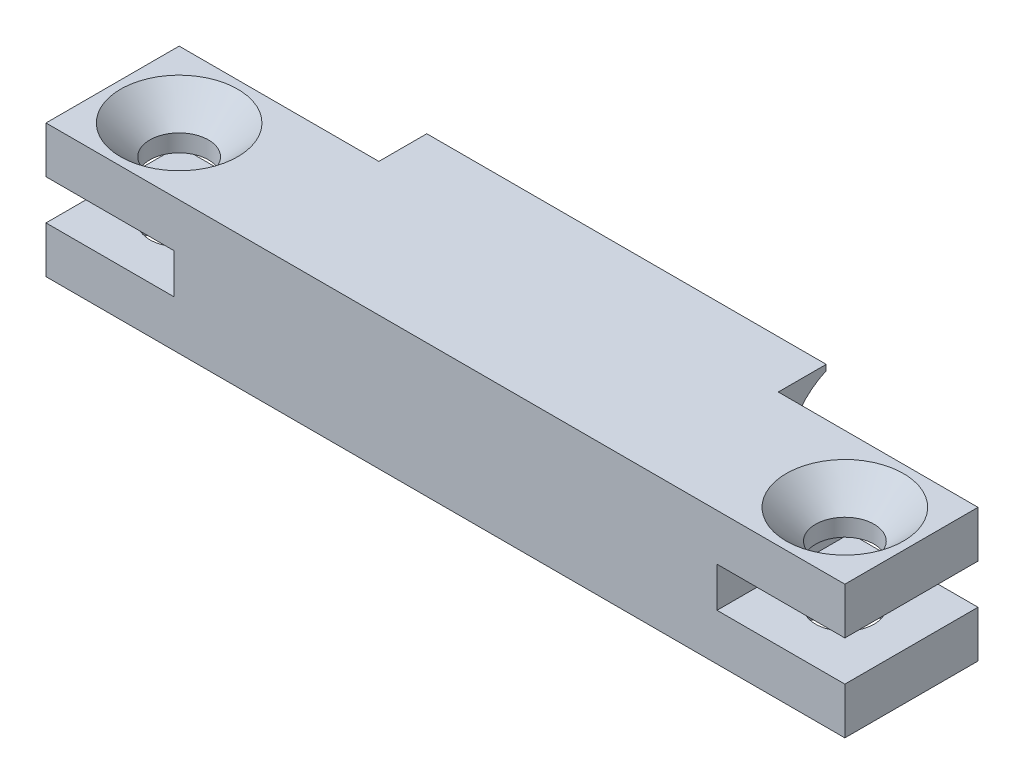
from build123d import *

# Parameters (mm, degrees)
EXTRUDE_1_DEPTH             = 15
SKETCH_2_W                  = 1
SKETCH_2_H                  = 1
CUT_EXTRUDE_1_DEPTH         = 15
SKETCH_6_W                  = 5
SKETCH_6_H                  = 1.75
EXTRUDE_2_DEPTH             = 7.5
SKETCH_7_W                  = 5
SKETCH_7_H                  = 1.75
EXTRUDE_3_DEPTH             = 7.5
HOLE_WIZARD_M21_D           = 2.2
HOLE_WIZARD_M21_CSINK_D     = 4.4
HOLE_WIZARD_M21_CSINK_ANGLE = 90
CUT_EXTRUDE_2_DEPTH         = 1.2
SKETCH_8_W                  = 2.7
SKETCH_8_H                  = 1.5
EXTRUDE_4_DEPTH             = 5


with BuildPart() as part:
    # Эскиз1 → Бобышка-Вытянуть1 (new body)
    with BuildSketch(Plane(origin=(0, 0, 0), x_dir=(0, 0, -1), z_dir=(1, 0, 0))):
        with BuildLine():
            Line((0, 2.5), (0, -2.5))
            Line((0, -2.5), (7.8, -2.5))
            ThreePointArc((7.8, -2.5), (5.3, 0), (7.8, 2.5))
            Line((7.8, 2.5), (0, 2.5))
        make_face()
    extrude(amount=EXTRUDE_1_DEPTH)

    # Эскиз2 → Вырез-Вытянуть1 (cut)
    with BuildSketch(Plane(origin=(15, 0, 0), x_dir=(0, 0, -1), z_dir=(1, 0, 0))):
        with Locations((7.3, 2)):
            Rectangle(SKETCH_2_W, SKETCH_2_H)
        with Locations((7.3, -2)):
            Rectangle(SKETCH_2_W, SKETCH_2_H)
    extrude(amount=-CUT_EXTRUDE_1_DEPTH, mode=Mode.SUBTRACT)

    # Эскиз6 → Бобышка-Вытянуть2 (add)
    with BuildSketch(Plane.ZY):
        with Locations((-2.5, 1.625)):
            Rectangle(SKETCH_6_W, SKETCH_6_H)
        with Locations((-2.5, -1.625)):
            Rectangle(SKETCH_6_W, SKETCH_6_H)
    extrude(amount=EXTRUDE_2_DEPTH)

    # Эскиз7 → Бобышка-Вытянуть3 (add)
    with BuildSketch(Plane(origin=(15, 0, 0), x_dir=(0, 0, -1), z_dir=(1, 0, 0))):
        with Locations((2.5, 1.625)):
            Rectangle(SKETCH_7_W, SKETCH_7_H)
        with Locations((2.5, -1.625)):
            Rectangle(SKETCH_7_W, SKETCH_7_H)
    extrude(amount=EXTRUDE_3_DEPTH)

    # Зенковка для винта с полупотайной головкой M21 (through all)
    with Locations(Plane(origin=(0, 2.5, 0), x_dir=(1, 0, 0), z_dir=(0, 1, 0))):
        with Locations((20, 2.5), (-5, 2.5)):
            CounterSinkHole(HOLE_WIZARD_M21_D / 2, HOLE_WIZARD_M21_CSINK_D / 2, counter_sink_angle=HOLE_WIZARD_M21_CSINK_ANGLE)

    # Эскиз5 → Вырез-Вытянуть2 (cut)
    with BuildSketch(Plane.XZ.offset(2.5)):
        Polygon((-6.178867871, -0.458141777), (-7.357735027, -2.500000412), (-6.178867157, -4.541858635), (-3.821132129, -4.541858223), (-2.642264973, -2.499999588), (-3.821132843, -0.458141365), align=None)
        Polygon((21.178867119, -4.541858635), (18.821132092, -4.541858223), (17.642264935, -2.499999588), (18.821132806, -0.458141365), (21.178867833, -0.458141777), (22.357734989, -2.500000412), align=None)
    extrude(amount=-CUT_EXTRUDE_2_DEPTH, mode=Mode.SUBTRACT)

    # Эскиз8 → Бобышка-Вытянуть4 (add)
    with BuildSketch(Plane.XY):
        with Locations((-1.35, 0)):
            Rectangle(SKETCH_8_W, SKETCH_8_H)
        with Locations((16.35, 0)):
            Rectangle(SKETCH_8_W, SKETCH_8_H)
    extrude(amount=-EXTRUDE_4_DEPTH)


solid = part.part
